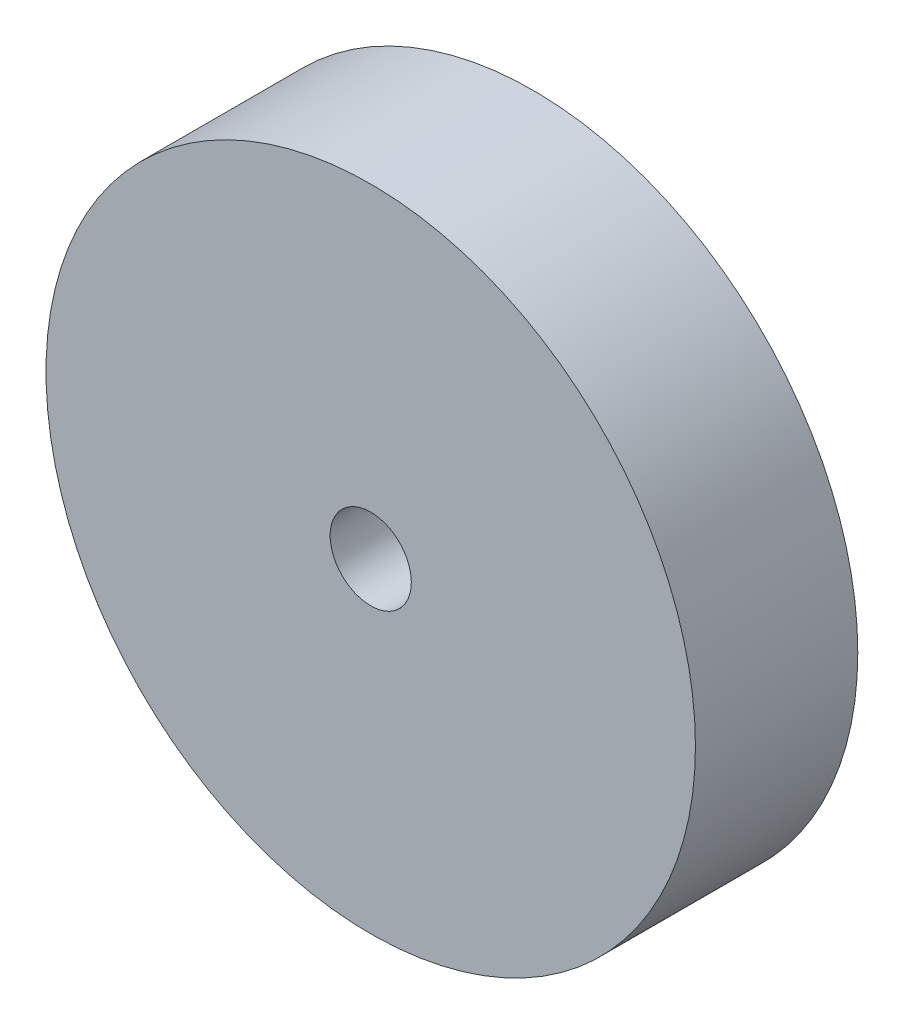
from build123d import *

# Parameters (mm, degrees)
SKETCH1_R           = 4
SKETCH1_R_2         = 0.5
BOSS_EXTRUDE1_DEPTH = 2


with BuildPart() as part:
    # Sketch1 → Boss-Extrude1 (new body)
    with BuildSketch(Plane.XY):
        Circle(SKETCH1_R)
        Circle(SKETCH1_R_2, mode=Mode.SUBTRACT)
    extrude(amount=BOSS_EXTRUDE1_DEPTH)


solid = part.part
